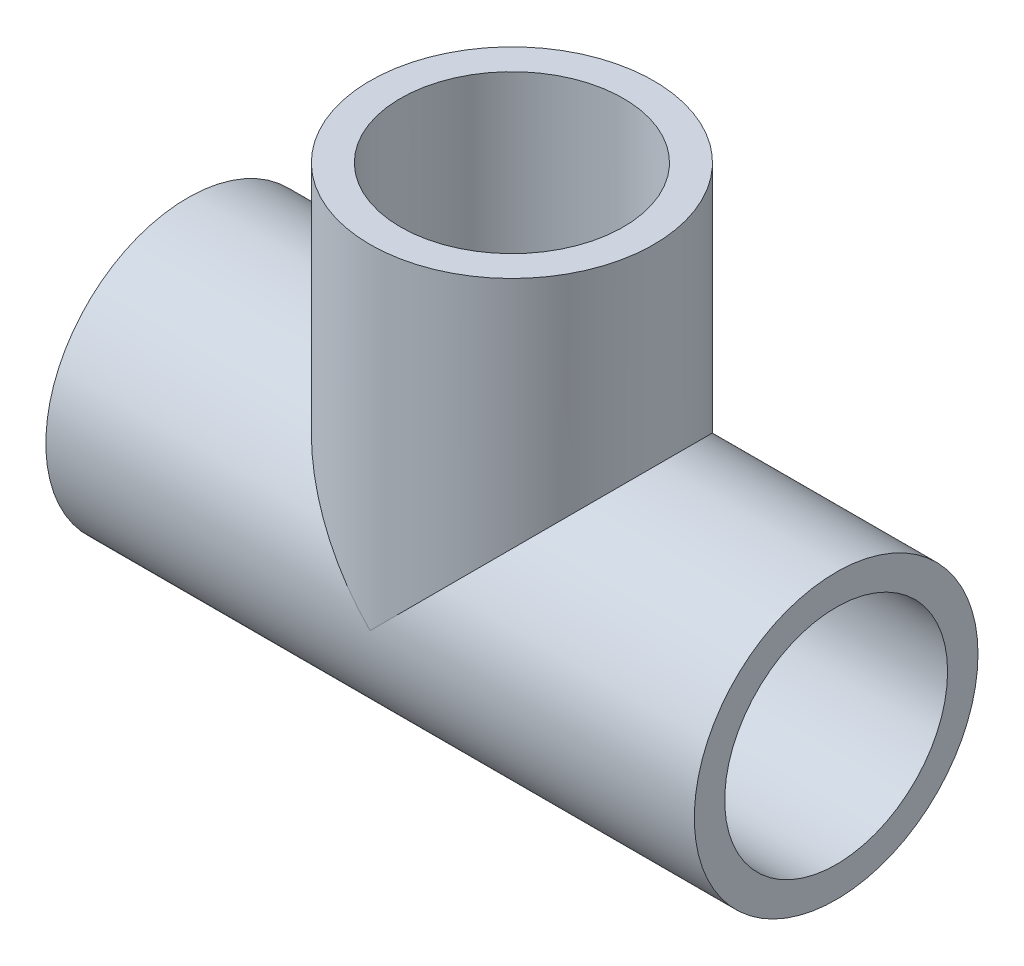
from build123d import *

# Parameters (mm, degrees)
SKETCH3_R           = 14
SKETCH3_R_2         = 11
SKETCH5_R           = 14
SKETCH5_R_2         = 11
BOSS_EXTRUDE1_DEPTH = 33
SKETCH6_R           = 11
CUT_EXTRUDE1_DEPTH  = 53
CUT_EXTRUDE2_START  = -33
SKETCH7_R           = 11
CUT_EXTRUDE2_DEPTH  = 33


with BuildPart() as part:
    # Sweep1: sweep along a path in Sketch1
    with BuildLine(Plane.XY) as sweep1_path:
        Line((32, 0), (-32, 0))
    # Sketch3 → Sweep1 (sweep)
    with BuildSketch(Plane(origin=(32, 0, 0), x_dir=(0, 0, -1), z_dir=(1, 0, 0))):
        Circle(SKETCH3_R)
        Circle(SKETCH3_R_2, mode=Mode.SUBTRACT)
    sweep(path=sweep1_path.line)

    # Sketch5 → Boss-Extrude1 (add)
    with BuildSketch(Plane(origin=(0, 0, 0), x_dir=(1, 0, 0), z_dir=(0, 1, 0))):
        with Locations(Location((0, 0, 0), (0, 0, 270))):
            Circle(SKETCH5_R)
        with Locations(Location((0, 0, 0), (0, 0, 90))):
            Circle(SKETCH5_R_2, mode=Mode.SUBTRACT)
    extrude(amount=BOSS_EXTRUDE1_DEPTH)

    # Sketch6 → Cut-Extrude1 (cut)
    with BuildSketch(Plane.ZY.offset(32)):
        with Locations(Location((0, 0, 0), (0, 0, 180))):
            Circle(SKETCH6_R)
    extrude(amount=-CUT_EXTRUDE1_DEPTH, mode=Mode.SUBTRACT)

    # Sketch7 → Cut-Extrude2 (cut)
    with BuildSketch(Plane(origin=(0, 33, 0), x_dir=(1, 0, 0), z_dir=(0, 1, 0)).offset(CUT_EXTRUDE2_START)):
        with Locations(Location((0, 0, 0), (0, 0, 270))):
            Circle(SKETCH7_R)
    extrude(amount=CUT_EXTRUDE2_DEPTH, mode=Mode.SUBTRACT)


solid = part.part
